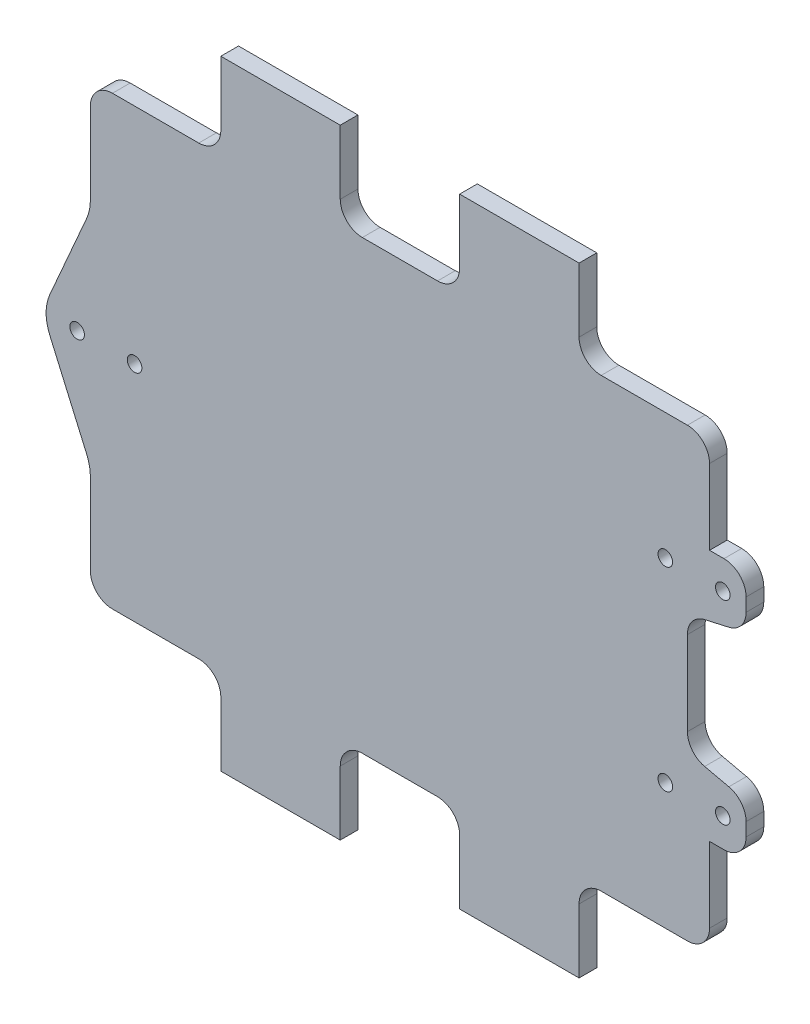
from build123d import *

# Parameters (mm, degrees)
BOSS_EXTRUDE1_DEPTH                             = 4
SKETCH3_W                                       = 29.5
SKETCH3_H                                       = 19.5
SKETCH3_W_2                                     = 27
CUT_EXTRUDE3_DEPTH                              = 195.527632999
BOSS_EXTRUDE2_DEPTH                             = 4
FILLET5_R                                       = 5
CSK_FOR_M3_FLAT_HEAD_MACHINE_SCREW1_D           = 3.3
CSK_FOR_M3_FLAT_HEAD_MACHINE_SCREW1_CSINK_D     = 6
CSK_FOR_M3_FLAT_HEAD_MACHINE_SCREW1_CSINK_ANGLE = 90
SKETCH8_R                                       = 1.65
CUT_EXTRUDE4_DEPTH                              = 204.958218206
FILLET6_R                                       = 5


with BuildPart() as part:
    # Sketch1 → Boss-Extrude1 (new body)
    with BuildSketch(Plane.XY):
        with BuildLine():
            Line((0, 0), (135, 0))
            Line((135, 0), (135, 140))
            Line((135, 140), (0, 140))
            Line((0, 140), (0, 97.072711728))
            ThreePointArc((0, 97.072711728), (-0.211219914, 95.028259617), (-0.835956887, 93.070173307))
            Line((-0.835956887, 93.070173307), (-9.164043113, 74.002538421))
            ThreePointArc((-9.164043113, 74.002538421), (-10, 70), (-9.164043113, 65.997461579))
            Line((-9.164043113, 65.997461579), (-0.835956887, 46.929826693))
            ThreePointArc((-0.835956887, 46.929826693), (-0.211219914, 44.971740383), (0, 42.927288272))
            Line((0, 42.927288272), (0, 0))
        make_face()
    extrude(amount=BOSS_EXTRUDE1_DEPTH)

    # Sketch3 → Cut-Extrude3 (cut, through all)
    with BuildSketch(Plane.XY.offset(4)):
        with Locations((14.75, 9.75)):
            Rectangle(SKETCH3_W, SKETCH3_H)
        with Locations((70, 9.75)):
            Rectangle(SKETCH3_W_2, SKETCH3_H)
        with Locations((125.25, 130.25)):
            Rectangle(SKETCH3_W, SKETCH3_H)
        with Locations((125.25, 9.75)):
            Rectangle(SKETCH3_W, SKETCH3_H)
        with Locations((14.75, 130.25)):
            Rectangle(SKETCH3_W, SKETCH3_H)
        with Locations((70, 130.25)):
            Rectangle(SKETCH3_W_2, SKETCH3_H)
    extrude(amount=-CUT_EXTRUDE3_DEPTH, mode=Mode.SUBTRACT)

    # Sketch9 → Boss-Extrude2 (add)
    with BuildSketch(Plane(origin=(0, 0, 0), x_dir=(-1, 0, 0), z_dir=(0, 0, -1))):
        Polygon((-140, 98.5), (-148.266499161, 98.5), (-148.266499161, 86.5), (-135, 83.5), (-135, 105.5), (-135, 120.5), (-140, 120.5), align=None)
        Polygon((-140, 19.5), (-140, 41.5), (-148.266499161, 41.5), (-148.266499161, 53.5), (-135, 56.5), (-135, 34.5), (-135, 19.5), align=None)
    extrude(amount=-BOSS_EXTRUDE2_DEPTH)

    # Fillet5
    fillet5_edges = [part.edges().sort_by_distance(p)[0] for p in [
        (135, 83.5, 2),
        (148.266499161, 86.5, 2),
        (148.266499161, 98.5, 2),
        (148.266499161, 41.5, 2),
        (148.266499161, 53.5, 2),
        (135, 56.5, 2),
    ]]
    fillet(fillet5_edges, radius=FILLET5_R)

    # CSK for M3 Flat Head Machine Screw1 (through all)
    with Locations(Plane(origin=(0, 0, 0), x_dir=(-1, 0, 0), z_dir=(0, 0, -1))):
        with Locations((-10, 70), (-130, 92), (-130, 48)):
            CounterSinkHole(CSK_FOR_M3_FLAT_HEAD_MACHINE_SCREW1_D / 2, CSK_FOR_M3_FLAT_HEAD_MACHINE_SCREW1_CSINK_D / 2, counter_sink_angle=CSK_FOR_M3_FLAT_HEAD_MACHINE_SCREW1_CSINK_ANGLE)

    # Sketch8 → Cut-Extrude4 (cut, through all)
    with BuildSketch(Plane(origin=(0, 0, 0), x_dir=(-1, 0, 0), z_dir=(0, 0, -1))):
        with Locations((3, 70)):
            Circle(SKETCH8_R)
        with Locations((-143, 92)):
            Circle(SKETCH8_R)
        with Locations((-143, 48)):
            Circle(SKETCH8_R)
    extrude(amount=-CUT_EXTRUDE4_DEPTH, mode=Mode.SUBTRACT)

    # Fillet6
    fillet6_edges = [part.edges().sort_by_distance(p)[0] for p in [
        (83.5, 120.5, 2),
        (56.5, 120.5, 2),
        (140, 120.5, 2),
        (140, 19.5, 2),
        (0, 19.5, 2),
        (29.5, 19.5, 2),
        (56.5, 19.5, 2),
        (83.5, 19.5, 2),
        (110.5, 19.5, 2),
        (110.5, 120.5, 2),
        (29.5, 120.5, 2),
        (0, 120.5, 2),
    ]]
    fillet(fillet6_edges, radius=FILLET6_R)


solid = part.part
